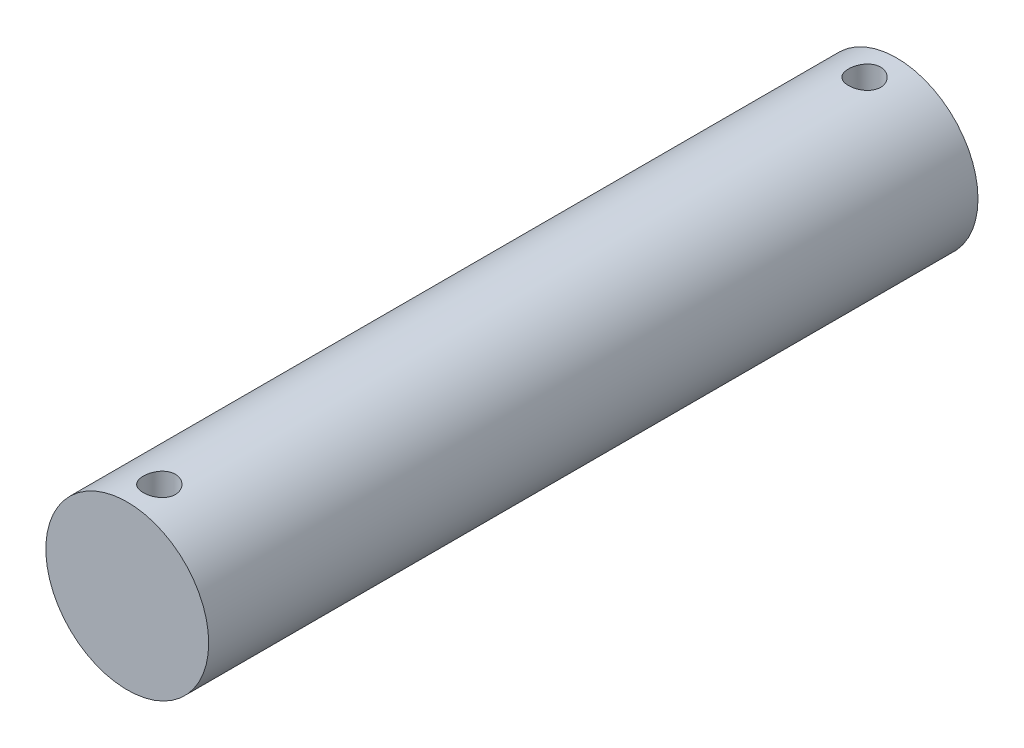
from build123d import *

# Parameters (mm, degrees)
SKETCH1_R           = 6.35
BOSS_EXTRUDE1_DEPTH = 30
SKETCH2_R           = 1.25
CUT_EXTRUDE1_DEPTH  = 25


with BuildPart() as part:
    # Sketch1 → Boss-Extrude1 (new, symmetric)
    with BuildSketch(Plane.XY):
        Circle(SKETCH1_R)
    extrude(amount=BOSS_EXTRUDE1_DEPTH, both=True)

    # Sketch2 → Cut-Extrude1 (cut, symmetric)
    with BuildSketch(Plane(origin=(0, 0, 0), x_dir=(1, 0, 0), z_dir=(0, 1, 0))):
        with Locations(Location((0, -27.5, 0), (0, 0, 270))):
            Circle(SKETCH2_R)
        with Locations(Location((0, 27.5, 0), (0, 0, 270))):
            Circle(SKETCH2_R)
    extrude(amount=CUT_EXTRUDE1_DEPTH, both=True, mode=Mode.SUBTRACT)


solid = part.part
